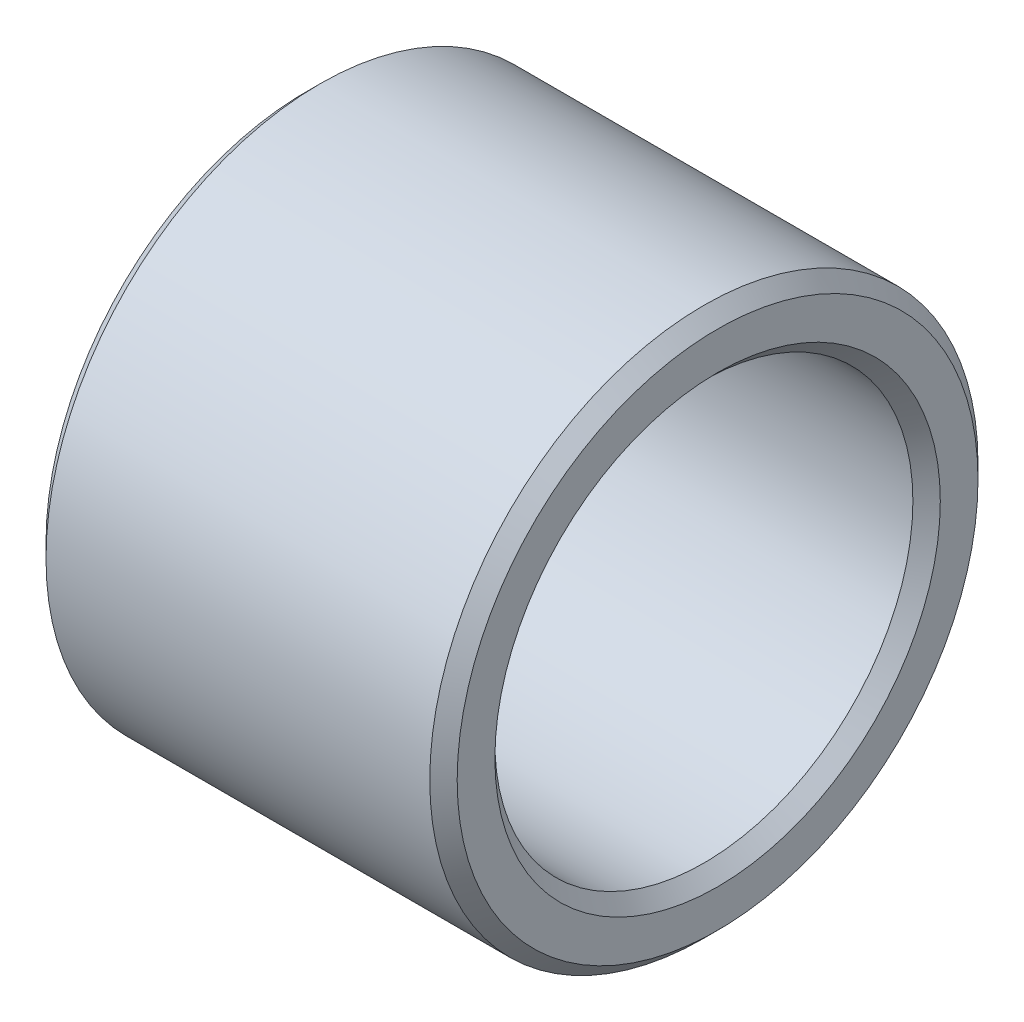
from build123d import *

# Parameters (mm, degrees)
SKETCH_1_W     = 30
SKETCH_1_H     = 4.75
CHAMFER_1_SIZE = 1
CHAMFER_2_SIZE = 1


with BuildPart() as part:
    # Эскиз1 → Повернуть1 (revolve)
    with BuildSketch(Plane.XY, mode=Mode.PRIVATE) as revolve_1_sk:
        with Locations((15, 17.625)):
            Rectangle(SKETCH_1_W, SKETCH_1_H)
    revolve(revolve_1_sk.sketch.rotate(Axis((0, 0, 0), (-1, 0, 0)), 90), axis=Axis((0, 0, 0), (-1, 0, 0)))

    # Фаска1
    chamfer_1_edges = [part.edges().sort_by_distance(p)[0] for p in [
        (0, 0, 20),
        (30, 0, 20),
    ]]
    chamfer(chamfer_1_edges, length=CHAMFER_1_SIZE)

    # Фаска2
    chamfer_2_edges = [part.edges().sort_by_distance(p)[0] for p in [
        (30, 0, 15.25),
        (0, 0, 15.25),
    ]]
    chamfer(chamfer_2_edges, length=CHAMFER_2_SIZE)


solid = part.part
